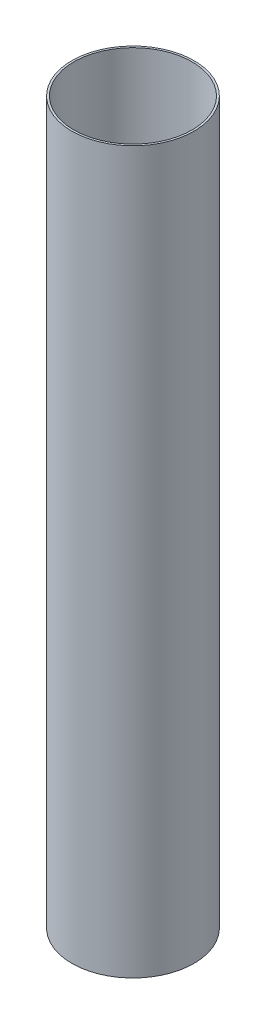
from build123d import *

# Parameters (mm, degrees)
ESQUISSE1_R        = 76.3
ESQUISSE1_R_2      = 73.8
BOSS_EXTRU_1_DEPTH = 900


with BuildPart() as part:
    # Esquisse1 → Boss.-Extru.1 (new body)
    with BuildSketch(Plane(origin=(0, 0, 0), x_dir=(1, 0, 0), z_dir=(0, 1, 0))):
        with Locations(Location((0, 0, 0), (0, 0, 270))):
            Circle(ESQUISSE1_R)
        with Locations(Location((0, 0, 0), (0, 0, 270))):
            Circle(ESQUISSE1_R_2, mode=Mode.SUBTRACT)
    extrude(amount=BOSS_EXTRU_1_DEPTH)


solid = part.part
